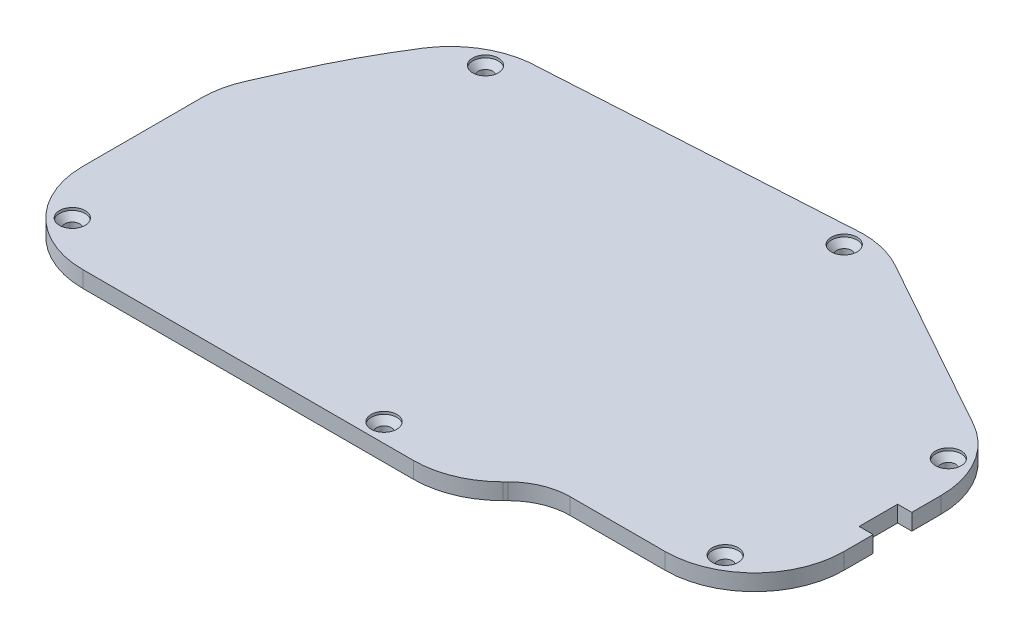
from build123d import *

# Parameters (mm, degrees)
SKETCH2_R                    = 1.425
BOSS_EXTRUDE1_DEPTH          = 3.175
SKETCH3_R                    = 2.5
CUT_EXTRUDE1_DEPTH           = 0.5
SKETCH4_R                    = 2.5
CUT_EXTRUDE2_DEPTH           = 1.2
CUT_EXTRUDE2_DRAFT           = -42
CUT_EXTRUDE2_PROFILE_2_DEPTH = 1.2
CUT_EXTRUDE2_PROFILE_2_DRAFT = -42
CUT_EXTRUDE2_PROFILE_3_DEPTH = 1.2
CUT_EXTRUDE2_PROFILE_3_DRAFT = -42
CUT_EXTRUDE2_PROFILE_4_DEPTH = 1.2
CUT_EXTRUDE2_PROFILE_4_DRAFT = -42
CUT_EXTRUDE2_PROFILE_5_DEPTH = 1.2
CUT_EXTRUDE2_PROFILE_5_DRAFT = -42
CUT_EXTRUDE2_PROFILE_6_DEPTH = 1.2
CUT_EXTRUDE2_PROFILE_6_DRAFT = -42


with BuildPart() as part:
    # Sketch2 → Boss-Extrude1 (new body)
    with BuildSketch(Plane(origin=(0, 0, 0), x_dir=(1, 0, 0), z_dir=(0, 1, 0))):
        with BuildLine():
            Line((-145.18277075, -44.880968233), (-179.497120097, -25.768390824))
            ThreePointArc((-179.497120097, -25.768390824), (-183.588653035, -24.128556812), (-187.960968922, -23.569494069))
            Line((-187.960968922, -23.569494069), (-247.377604545, -27.068041697))
            ThreePointArc((-247.377604545, -27.068041697), (-255.760524502, -29.218913898), (-262.07032604, -35.142257782))
            ThreePointArc((-262.07032604, -35.142257782), (-266.807761783, -43.251676507), (-270.933745897, -51.688632391))
            Line((-270.933745897, -51.688632391), (-273.728235609, -57.981701498))
            ThreePointArc((-273.728235609, -57.981701498), (-274.847170355, -61.434035543), (-275.2256366, -65.043382939))
            Line((-275.2256366, -65.043382939), (-275.2256366, -88.130010281))
            ThreePointArc((-275.2256366, -88.130010281), (-270.129294593, -100.433668273), (-257.8256366, -105.530010281))
            Line((-257.8256366, -105.530010281), (-193.494425739, -105.530010281))
            ThreePointArc((-193.494425739, -105.530010281), (-186.835734016, -104.205514146), (-181.190767747, -100.433668273))
            Line((-181.190767747, -100.433668273), (-180.680815133, -99.923715659))
            ThreePointArc((-180.680815133, -99.923715659), (-176.755292612, -97.300765368), (-172.12482308, -96.379707712))
            Line((-172.12482308, -96.379707712), (-153.649556898, -96.379707712))
            ThreePointArc((-153.649556898, -96.379707712), (-141.345898905, -91.283365704), (-136.249556898, -78.979707712))
            Line((-136.249556898, -78.979707712), (-136.249556898, -73.280889471))
            Line((-136.249556898, -73.280889471), (-138.999556898, -73.280889471))
            Line((-138.999556898, -73.280889471), (-138.999556898, -65.780889471))
            Line((-138.999556898, -65.780889471), (-136.249556898, -65.780889471))
            Line((-136.249556898, -65.780889471), (-136.249556898, -60.08207123))
            ThreePointArc((-136.249556898, -60.08207123), (-138.648188978, -51.266235449), (-145.18277075, -44.880968233))
        make_face()
        with Locations(Location((-147.207602145, -91.127288498, 0), (0, 0, 270))):
            Circle(SKETCH2_R, mode=Mode.SUBTRACT)
        with Locations(Location((-141.795027651, -53.115534334, 0), (0, 0, 270))):
            Circle(SKETCH2_R, mode=Mode.SUBTRACT)
        with Locations(Location((-187.963906245, -27.219493821, 0), (0, 0, 270))):
            Circle(SKETCH2_R, mode=Mode.SUBTRACT)
        with Locations(Location((-253.051529835, -31.941972813, 0), (0, 0, 270))):
            Circle(SKETCH2_R, mode=Mode.SUBTRACT)
        with Locations(Location((-267.548354841, -97.852728522, 0), (0, 0, 270))):
            Circle(SKETCH2_R, mode=Mode.SUBTRACT)
        with Locations(Location((-202.85468144, -101.880010281, 0), (0, 0, 270))):
            Circle(SKETCH2_R, mode=Mode.SUBTRACT)
    extrude(amount=BOSS_EXTRUDE1_DEPTH)

    # Sketch3 → Cut-Extrude1 (cut)
    with BuildSketch(Plane(origin=(0, 3.175, 0), x_dir=(1, 0, 0), z_dir=(0, 1, 0))):
        with Locations(Location((-253.051529835, -31.941972813, 0), (0, 0, 270))):
            Circle(SKETCH3_R)
        with Locations(Location((-187.963906245, -27.219493821, 0), (0, 0, 270))):
            Circle(SKETCH3_R)
        with Locations(Location((-141.795027651, -53.115534334, 0), (0, 0, 270))):
            Circle(SKETCH3_R)
        with Locations(Location((-147.207602145, -91.127288498, 0), (0, 0, 270))):
            Circle(SKETCH3_R)
        with Locations(Location((-202.85468144, -101.880010281, 0), (0, 0, 270))):
            Circle(SKETCH3_R)
        with Locations(Location((-267.548354841, -97.852728522, 0), (0, 0, 270))):
            Circle(SKETCH3_R)
    extrude(amount=-CUT_EXTRUDE1_DEPTH, mode=Mode.SUBTRACT)


with BuildPart() as cut_extrude2_tool:
    # Sketch4 → Cut-Extrude2 (with draft: the straight prism first)
    with BuildSketch(Plane(origin=(0, 2.675, 0), x_dir=(1, 0, 0), z_dir=(0, 1, 0))):
        with Locations(Location((-267.548354841, -97.852728522, 0), (0, 0, 270))):
            Circle(SKETCH4_R)
    extrude(amount=-CUT_EXTRUDE2_DEPTH)
    # Cut-Extrude2: the draft: its side faces are tilted about the plane it starts from
    cut_extrude2_sides = [cut_extrude2_tool.faces().sort_by_distance(p)[0] for p in [
        (-267.548354841, 2.075, 95.352728522),
    ]]
    draft(cut_extrude2_sides, Plane(origin=(0, 2.675, 0), x_dir=(1, 0, 0), z_dir=(0, 1, 0)), CUT_EXTRUDE2_DRAFT)


with BuildPart() as part_1:
    add(part.part)

    # Cut-Extrude2: cut by cut_extrude2_tool
    add(cut_extrude2_tool.part, mode=Mode.SUBTRACT)


with BuildPart() as cut_extrude2_profile_2_tool:
    # Sketch4 → Cut-Extrude2 profile 2 (with draft: the straight prism first)
    with BuildSketch(Plane(origin=(0, 2.675, 0), x_dir=(1, 0, 0), z_dir=(0, 1, 0))):
        with Locations(Location((-202.85468144, -101.880010281, 0), (0, 0, 270))):
            Circle(SKETCH4_R)
    extrude(amount=-CUT_EXTRUDE2_PROFILE_2_DEPTH)
    # Cut-Extrude2 profile 2: the draft: its side faces are tilted about the plane it starts from
    cut_extrude2_profile_2_sides = [cut_extrude2_profile_2_tool.faces().sort_by_distance(p)[0] for p in [
        (-202.85468144, 2.075, 99.380010281),
    ]]
    draft(cut_extrude2_profile_2_sides, Plane(origin=(0, 2.675, 0), x_dir=(1, 0, 0), z_dir=(0, 1, 0)), CUT_EXTRUDE2_PROFILE_2_DRAFT)


with BuildPart() as part_2:
    add(part_1.part)

    # Cut-Extrude2 profile 2: cut by cut_extrude2_profile_2_tool
    add(cut_extrude2_profile_2_tool.part, mode=Mode.SUBTRACT)


with BuildPart() as cut_extrude2_profile_3_tool:
    # Sketch4 → Cut-Extrude2 profile 3 (with draft: the straight prism first)
    with BuildSketch(Plane(origin=(0, 2.675, 0), x_dir=(1, 0, 0), z_dir=(0, 1, 0))):
        with Locations(Location((-147.207602145, -91.127288498, 0), (0, 0, 270))):
            Circle(SKETCH4_R)
    extrude(amount=-CUT_EXTRUDE2_PROFILE_3_DEPTH)
    # Cut-Extrude2 profile 3: the draft: its side faces are tilted about the plane it starts from
    cut_extrude2_profile_3_sides = [cut_extrude2_profile_3_tool.faces().sort_by_distance(p)[0] for p in [
        (-147.207602145, 2.075, 88.627288498),
    ]]
    draft(cut_extrude2_profile_3_sides, Plane(origin=(0, 2.675, 0), x_dir=(1, 0, 0), z_dir=(0, 1, 0)), CUT_EXTRUDE2_PROFILE_3_DRAFT)


with BuildPart() as part_3:
    add(part_2.part)

    # Cut-Extrude2 profile 3: cut by cut_extrude2_profile_3_tool
    add(cut_extrude2_profile_3_tool.part, mode=Mode.SUBTRACT)


with BuildPart() as cut_extrude2_profile_4_tool:
    # Sketch4 → Cut-Extrude2 profile 4 (with draft: the straight prism first)
    with BuildSketch(Plane(origin=(0, 2.675, 0), x_dir=(1, 0, 0), z_dir=(0, 1, 0))):
        with Locations(Location((-141.795027651, -53.115534334, 0), (0, 0, 270))):
            Circle(SKETCH4_R)
    extrude(amount=-CUT_EXTRUDE2_PROFILE_4_DEPTH)
    # Cut-Extrude2 profile 4: the draft: its side faces are tilted about the plane it starts from
    cut_extrude2_profile_4_sides = [cut_extrude2_profile_4_tool.faces().sort_by_distance(p)[0] for p in [
        (-141.795027651, 2.075, 50.615534334),
    ]]
    draft(cut_extrude2_profile_4_sides, Plane(origin=(0, 2.675, 0), x_dir=(1, 0, 0), z_dir=(0, 1, 0)), CUT_EXTRUDE2_PROFILE_4_DRAFT)


with BuildPart() as part_4:
    add(part_3.part)

    # Cut-Extrude2 profile 4: cut by cut_extrude2_profile_4_tool
    add(cut_extrude2_profile_4_tool.part, mode=Mode.SUBTRACT)


with BuildPart() as cut_extrude2_profile_5_tool:
    # Sketch4 → Cut-Extrude2 profile 5 (with draft: the straight prism first)
    with BuildSketch(Plane(origin=(0, 2.675, 0), x_dir=(1, 0, 0), z_dir=(0, 1, 0))):
        with Locations(Location((-187.963906245, -27.219493821, 0), (0, 0, 270))):
            Circle(SKETCH4_R)
    extrude(amount=-CUT_EXTRUDE2_PROFILE_5_DEPTH)
    # Cut-Extrude2 profile 5: the draft: its side faces are tilted about the plane it starts from
    cut_extrude2_profile_5_sides = [cut_extrude2_profile_5_tool.faces().sort_by_distance(p)[0] for p in [
        (-187.963906245, 2.075, 24.719493821),
    ]]
    draft(cut_extrude2_profile_5_sides, Plane(origin=(0, 2.675, 0), x_dir=(1, 0, 0), z_dir=(0, 1, 0)), CUT_EXTRUDE2_PROFILE_5_DRAFT)


with BuildPart() as part_5:
    add(part_4.part)

    # Cut-Extrude2 profile 5: cut by cut_extrude2_profile_5_tool
    add(cut_extrude2_profile_5_tool.part, mode=Mode.SUBTRACT)


with BuildPart() as cut_extrude2_profile_6_tool:
    # Sketch4 → Cut-Extrude2 profile 6 (with draft: the straight prism first)
    with BuildSketch(Plane(origin=(0, 2.675, 0), x_dir=(1, 0, 0), z_dir=(0, 1, 0))):
        with Locations(Location((-253.051529835, -31.941972813, 0), (0, 0, 270))):
            Circle(SKETCH4_R)
    extrude(amount=-CUT_EXTRUDE2_PROFILE_6_DEPTH)
    # Cut-Extrude2 profile 6: the draft: its side faces are tilted about the plane it starts from
    cut_extrude2_profile_6_sides = [cut_extrude2_profile_6_tool.faces().sort_by_distance(p)[0] for p in [
        (-253.051529835, 2.075, 29.441972813),
    ]]
    draft(cut_extrude2_profile_6_sides, Plane(origin=(0, 2.675, 0), x_dir=(1, 0, 0), z_dir=(0, 1, 0)), CUT_EXTRUDE2_PROFILE_6_DRAFT)


with BuildPart() as part_6:
    add(part_5.part)

    # Cut-Extrude2 profile 6: cut by cut_extrude2_profile_6_tool
    add(cut_extrude2_profile_6_tool.part, mode=Mode.SUBTRACT)


solid = part_6.part
